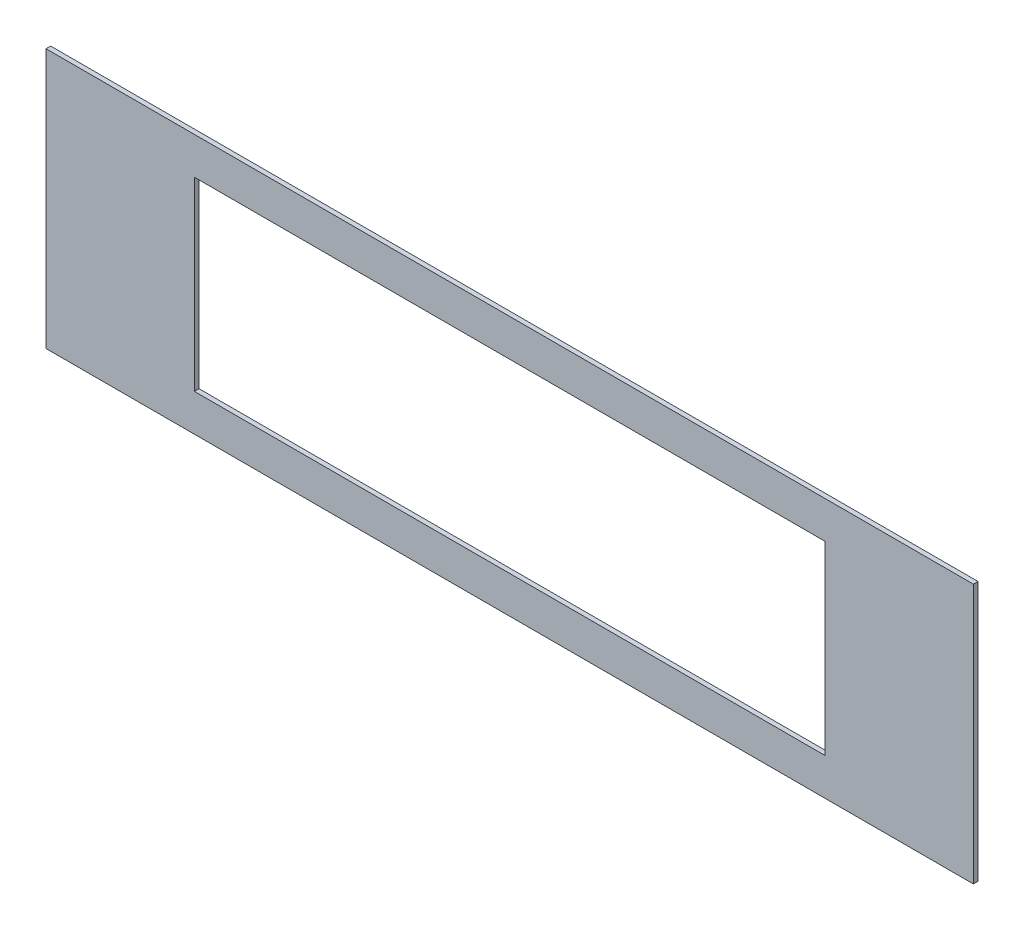
from build123d import *

# Parameters (mm, degrees)
SKETCH1_W           = 1270
SKETCH1_H           = 355.6
SKETCH1_W_2         = 863.6
SKETCH1_H_2         = 254
BOSS_EXTRUDE1_DEPTH = 6.35


with BuildPart() as part:
    # Sketch1 → Boss-Extrude1 (new body)
    with BuildSketch(Plane.XY):
        Rectangle(SKETCH1_W, SKETCH1_H)
        Rectangle(SKETCH1_W_2, SKETCH1_H_2, mode=Mode.SUBTRACT)
    extrude(amount=BOSS_EXTRUDE1_DEPTH)


solid = part.part
